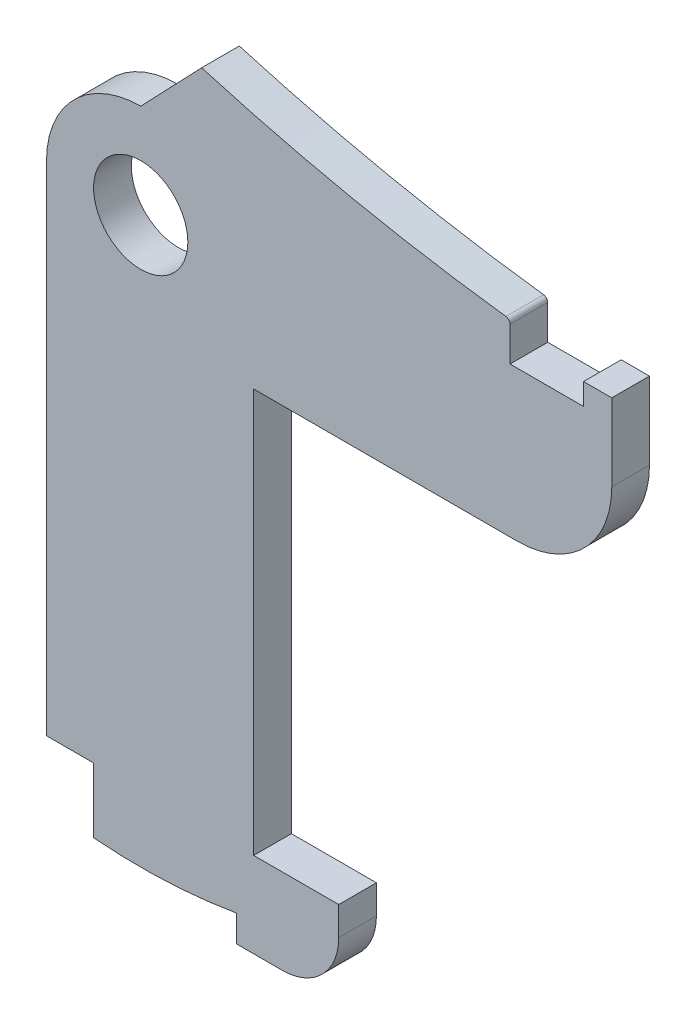
from build123d import *

# Parameters (mm, degrees)
SKETCH_1_R      = 2.5
EXTRUDE_1_DEPTH = 2


with BuildPart() as part:
    # 스케치1 → 보스-돌출1 (new body)
    with BuildSketch(Plane.XY):
        with BuildLine():
            Line((20.887065526, -4.904042543), (17.65515334, -8.287321674))
            ThreePointArc((17.65515334, -8.287321674), (14.119619434, -9.751787768), (12.65515334, -13.287321674))
            Line((12.65515334, -13.287321674), (12.65515334, -39.724999499))
            Line((12.65515334, -39.724999499), (15.15515334, -39.724999499))
            Line((15.15515334, -39.724999499), (15.15515334, -43.161796007))
            ThreePointArc((15.15515334, -43.161796007), (18.953651475, -43.238083254), (22.731294666, -42.833336733))
            Line((22.731294666, -42.833336733), (22.731294666, -44.249079054))
            Line((22.731294666, -44.249079054), (25.163405743, -44.249079054))
            ThreePointArc((25.163405743, -44.249079054), (27.284726086, -43.370399397), (28.163405743, -41.249079054))
            Line((28.163405743, -41.249079054), (28.163405743, -39.724999499))
            Line((28.163405743, -39.724999499), (25.906714003, -39.724999499))
            Line((25.906714003, -39.724999499), (23.650022264, -39.724999499))
            Line((23.650022264, -39.724999499), (23.650022264, -18.287321674))
            Line((23.650022264, -18.287321674), (37.65515334, -18.287321674))
            ThreePointArc((37.65515334, -18.287321674), (41.190687246, -16.82285558), (42.65515334, -13.287321674))
            Line((42.65515334, -13.287321674), (42.65515334, -9.191405084))
            Line((42.65515334, -9.191405084), (41.15515334, -9.191405084))
            Line((41.15515334, -9.191405084), (41.15515334, -10.336593208))
            Line((41.15515334, -10.336593208), (37.25515334, -10.336593208))
            Line((37.25515334, -10.336593208), (37.25515334, -8.508126005))
            ThreePointArc((37.25515334, -8.508126005), (37.192620725, -8.342729573), (37.036305504, -8.260074513))
            ThreePointArc((37.036305504, -8.260074513), (28.894559444, -6.905069462), (20.887065526, -4.904042543))
        make_face()
        with Locations((17.65515334, -13.287321674)):
            Circle(SKETCH_1_R, mode=Mode.SUBTRACT)
    extrude(amount=EXTRUDE_1_DEPTH)


solid = part.part
